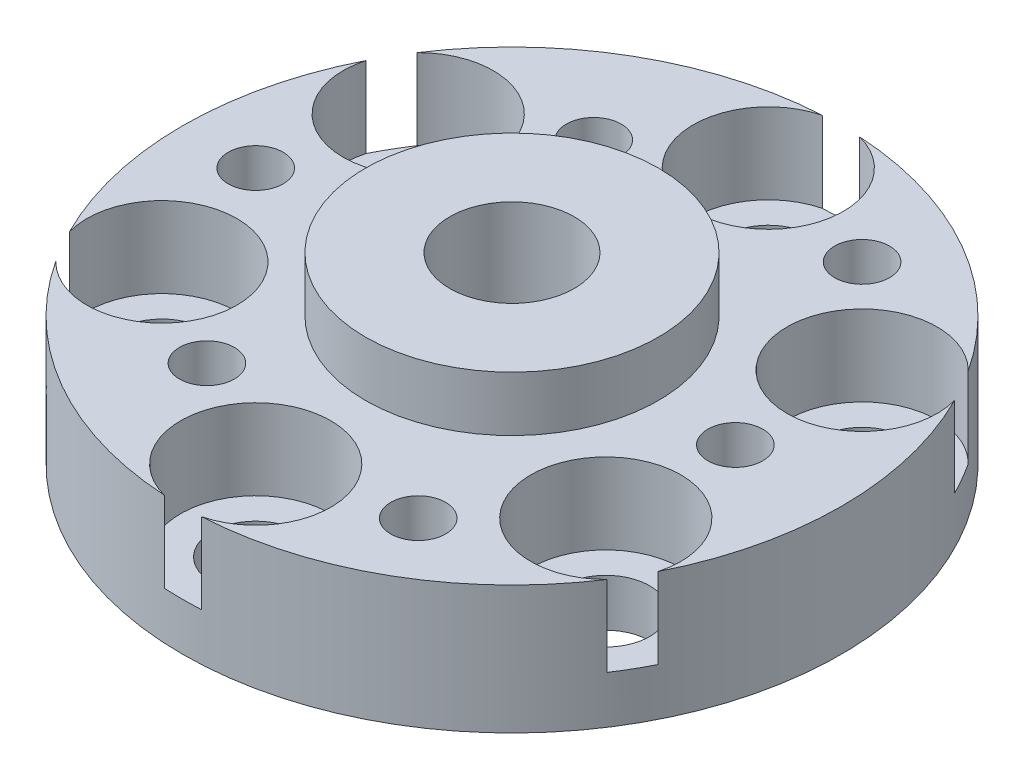
from build123d import *

# Parameters (mm, degrees)
SKETCH1_R                                           = 18
BOSS_EXTRUDE1_DEPTH                                 = 7
CBORE_FOR_M4_HEX_SOCKET_HEAD_CAP_SCREW2_D           = 4.8
CBORE_FOR_M4_HEX_SOCKET_HEAD_CAP_SCREW2_DEPTH       = 10
CBORE_FOR_M4_HEX_SOCKET_HEAD_CAP_SCREW2_CBORE_D     = 8.2
CBORE_FOR_M4_HEX_SOCKET_HEAD_CAP_SCREW2_CBORE_DEPTH = 4.4
CBORE_FOR_M4_HEX_SOCKET_HEAD_CAP_SCREW2_TIP         = 1.442065486
F_3_0MM_DOWEL_HOLE1_D                               = 3
F_3_0MM_DOWEL_HOLE1_DEPTH                           = 10
F_3_0MM_DOWEL_HOLE1_TIP                             = 0.901290929
F_3_0MM_DOWEL_HOLE2_D                               = 3
F_3_0MM_DOWEL_HOLE2_DEPTH                           = 10
F_3_0MM_DOWEL_HOLE2_TIP                             = 0.901290929
SKETCH8_R                                           = 8
BOSS_EXTRUDE2_DEPTH                                 = 3
TAP_DRILL_FOR_M8_TAP1_D                             = 6.8


with BuildPart() as part:
    # Sketch1 → Boss-Extrude1 (new body)
    with BuildSketch(Plane(origin=(0, 0, 0), x_dir=(1, 0, 0), z_dir=(0, 1, 0))):
        with Locations(Location((0, 0, 0), (0, 0, 270))):
            Circle(SKETCH1_R)
    extrude(amount=BOSS_EXTRUDE1_DEPTH)

    # CBORE for M4 Hex Socket Head Cap Screw2
    with Locations(Plane(origin=(0, 7, 0), x_dir=(1, 0, 0), z_dir=(0, 1, 0))):
        with Locations((-12.124355653, 7), (0, 14), (12.124355653, 7), (12.124355653, -7), (0, -14), (-12.124355653, -7)):
            CounterBoreHole(CBORE_FOR_M4_HEX_SOCKET_HEAD_CAP_SCREW2_D / 2, CBORE_FOR_M4_HEX_SOCKET_HEAD_CAP_SCREW2_CBORE_D / 2, CBORE_FOR_M4_HEX_SOCKET_HEAD_CAP_SCREW2_CBORE_DEPTH, depth=CBORE_FOR_M4_HEX_SOCKET_HEAD_CAP_SCREW2_DEPTH)
            with Locations((0, 0, -(CBORE_FOR_M4_HEX_SOCKET_HEAD_CAP_SCREW2_DEPTH + CBORE_FOR_M4_HEX_SOCKET_HEAD_CAP_SCREW2_TIP / 2))):  # 118° drill point
                Cone(0, CBORE_FOR_M4_HEX_SOCKET_HEAD_CAP_SCREW2_D / 2, CBORE_FOR_M4_HEX_SOCKET_HEAD_CAP_SCREW2_TIP, mode=Mode.SUBTRACT)

    # Ø3.0mm Dowel Hole1
    with Locations(Plane(origin=(0, 7, 0), x_dir=(1, 0, 0), z_dir=(0, 1, 0))):
        with Locations((7, -12.124355653), (-14, 0), (7, 12.124355653)):
            Hole(F_3_0MM_DOWEL_HOLE1_D / 2, depth=F_3_0MM_DOWEL_HOLE1_DEPTH)
            with Locations((0, 0, -(F_3_0MM_DOWEL_HOLE1_DEPTH + F_3_0MM_DOWEL_HOLE1_TIP / 2))):  # 118° drill point
                Cone(0, F_3_0MM_DOWEL_HOLE1_D / 2, F_3_0MM_DOWEL_HOLE1_TIP, mode=Mode.SUBTRACT)

    # Ø3.0mm Dowel Hole2
    with Locations(Plane(origin=(0, 7, 0), x_dir=(1, 0, 0), z_dir=(0, 1, 0))):
        with Locations((-6.1, 10.565509926), (12.2, 0), (-6.1, -10.565509926)):
            Hole(F_3_0MM_DOWEL_HOLE2_D / 2, depth=F_3_0MM_DOWEL_HOLE2_DEPTH)
            with Locations((0, 0, -(F_3_0MM_DOWEL_HOLE2_DEPTH + F_3_0MM_DOWEL_HOLE2_TIP / 2))):  # 118° drill point
                Cone(0, F_3_0MM_DOWEL_HOLE2_D / 2, F_3_0MM_DOWEL_HOLE2_TIP, mode=Mode.SUBTRACT)

    # Sketch8 → Boss-Extrude2 (add)
    with BuildSketch(Plane(origin=(0, 7, 0), x_dir=(1, 0, 0), z_dir=(0, 1, 0))):
        with Locations(Location((0, 0, 0), (0, 0, 270))):
            Circle(SKETCH8_R)
    extrude(amount=BOSS_EXTRUDE2_DEPTH)

    # Tap Drill for M8 Tap1 (through all)
    with Locations(Plane(origin=(0, 10, 0), x_dir=(1, 0, 0), z_dir=(0, 1, 0))):
        with Locations((0, 0)):
            Hole(TAP_DRILL_FOR_M8_TAP1_D / 2)


solid = part.part
